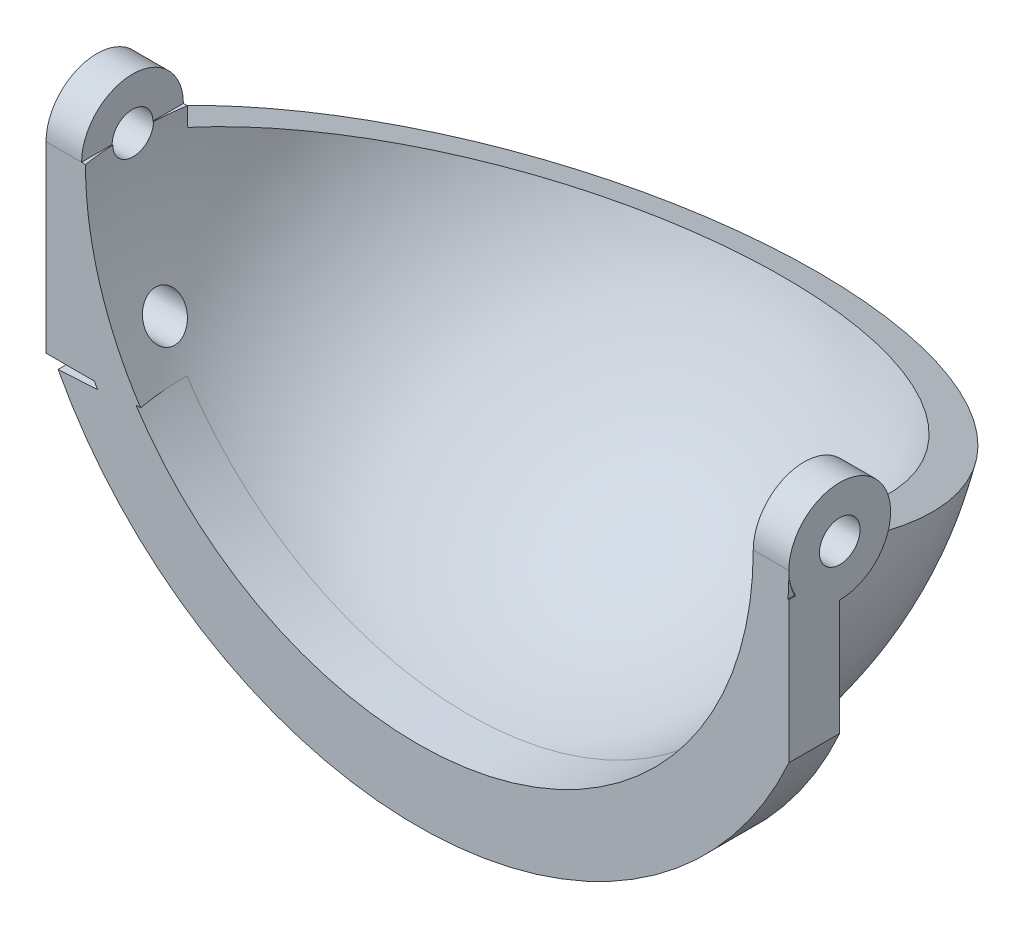
from build123d import *
from build123d.topology import SkipClean

# Parameters (mm, degrees)
EXTRUDE_1_DEPTH          = 2.5
REVOLVE_1_ANGLE          = 70
EXTRUDE_2_DEPTH          = 18.25
EXTRUDE_2_DEPTH_BACK     = 18.25
SKETCH_4_R               = 2.5
SKETCH_4_R_2             = 1
CUT_EXTRUDE_1_DEPTH      = 16.5
CUT_EXTRUDE_1_DEPTH_BACK = 16.5
SKETCH_7_R               = 2.5
SKETCH_7_R_2             = 1
CUT_EXTRUDE_2_DEPTH      = 100
CUT_EXTRUDE_2_DEPTH_BACK = 100
SKETCH_8_R               = 1
EXTRUDE_START            = -5
SKETCH_9_R               = 1
EXTRUDE_3_DEPTH          = 5
CUT_EXTRUDE_START        = -5
SKETCH_12_R              = 1
CUT_EXTRUDE_3_DEPTH      = 5
EXTRUDE_4_DEPTH          = 2.5
CUT_EXTRUDE_4_DEPTH      = 2.5


with BuildPart() as part:
    # 草图1 → 凸台-拉伸1 (new body)
    with BuildSketch(Plane.XY):
        with BuildLine():
            Line((-18.25, 0), (-16.5, 0))
            ThreePointArc((-16.5, 0), (0, -16.5), (16.5, 0))
            Line((16.5, 0), (18.25, 0))
            ThreePointArc((18.25, 0), (0, -18.25), (-18.25, 0))
        make_face()
    extrude(amount=EXTRUDE_1_DEPTH)

    # 草图2 → 旋转1 (revolve)
    with BuildSketch(Plane(origin=(0, 0, 0), x_dir=(-1, 0, 0), z_dir=(0, 0, -1))):
        with BuildLine():
            Line((-17.375, 0), (-16.5, 0))
            ThreePointArc((-16.5, 0), (0, -16.5), (16.5, 0))
            Line((16.5, 0), (17.375, 0))
            Line((17.375, 0), (18.25, 0))
            ThreePointArc((18.25, 0), (0, -18.25), (-18.25, 0))
            Line((-18.25, 0), (-17.375, 0))
        make_face()
    revolve(axis=Axis((16.5, 0, 0), (1, 0, 0)), revolution_arc=REVOLVE_1_ANGLE)

    # 草图4 → 凸台-拉伸2 (add, two sides: drawn at the far end of the back side and taken through both)
    with BuildSketch(Plane(origin=(0, 0, 0), x_dir=(0, 0, -1), z_dir=(1, 0, 0)).offset(-EXTRUDE_2_DEPTH_BACK)):
        Circle(SKETCH_4_R)
        Circle(SKETCH_4_R_2, mode=Mode.SUBTRACT)
    extrude(amount=EXTRUDE_2_DEPTH + EXTRUDE_2_DEPTH_BACK)

    # 草图7 → 切除-拉伸1 (cut, two sides: drawn at the far end of the back side and taken through both)
    with SkipClean():  # the faces are left unmerged after this step: merging them gives an invalid solid
        with BuildSketch(Plane(origin=(0, 0, 0), x_dir=(0, 0, -1), z_dir=(1, 0, 0)).offset(-CUT_EXTRUDE_1_DEPTH_BACK)):
            Circle(SKETCH_7_R)
            Circle(SKETCH_7_R_2, mode=Mode.SUBTRACT)
        extrude(amount=CUT_EXTRUDE_1_DEPTH + CUT_EXTRUDE_1_DEPTH_BACK, mode=Mode.SUBTRACT)

    # 草图8 → 切除-拉伸2 (cut, two sides: drawn at the far end of the back side and taken through both)
    with BuildSketch(Plane(origin=(0, 0, 0), x_dir=(0, 0, -1), z_dir=(1, 0, 0)).offset(-CUT_EXTRUDE_2_DEPTH_BACK)):
        Circle(SKETCH_8_R)
    extrude(amount=CUT_EXTRUDE_2_DEPTH + CUT_EXTRUDE_2_DEPTH_BACK, mode=Mode.SUBTRACT)

    # 草图9 → 凸台-拉伸3 (add)
    with BuildSketch(Plane.ZY.offset(18.25).offset(EXTRUDE_START)):
        with BuildLine():
            Line((1, 0), (2.5, 0))
            Line((2.5, 0), (2.5, -9))
            Line((2.5, -9), (-2.5, -9))
            Line((-2.5, -9), (-2.5, 0))
            Line((-2.5, 0), (-1, 0))
            ThreePointArc((-1, 0), (0, -1), (1, 0))
        make_face()
        with Locations((0, -7)):
            Circle(SKETCH_9_R, mode=Mode.SUBTRACT)
    extrude(amount=EXTRUDE_3_DEPTH)

    # 草图12 → 切除-拉伸3 (cut)
    with BuildSketch(Plane.ZY.offset(18.25).offset(CUT_EXTRUDE_START)):
        with Locations((0, -7)):
            Circle(SKETCH_12_R)
    extrude(amount=CUT_EXTRUDE_3_DEPTH, mode=Mode.SUBTRACT)

    # 草图13 → 切除-旋转1 (revolve, cut)
    with BuildSketch(Plane.XY):
        with BuildLine():
            Line((16.5, 0), (-16.5, 0))
            ThreePointArc((-16.5, 0), (0, -16.5), (16.5, 0))
        make_face()
    revolve(axis=Axis((16.5, 0, 0), (-1, 0, 0)), mode=Mode.SUBTRACT)

    # 草图14 → 凸台-拉伸4 (add)
    with BuildSketch(Plane.XY):
        with BuildLine():
            Line((16.5, -1), (19.945657674, -1.473343123))
            ThreePointArc((19.945657674, -1.473343123), (4.12178771, -19.570663404), (-17.657116061, -9.392883071))
            Line((-17.657116061, -9.392883071), (-13.750126888, -9.175184497))
            ThreePointArc((-13.750126888, -9.175184497), (4.31263967, -15.957792425), (16.5, -1))
        make_face()
    extrude(amount=EXTRUDE_4_DEPTH)

    # 草图15 → 切除-拉伸4 (cut)
    with BuildSketch(Plane(origin=(0, 0, 0), x_dir=(-1, 0, 0), z_dir=(0, 0, -1))):
        Polygon((-19.945657674, -1.473343123), (-18.25, -1.240404168), (-18.25, -11.043121242), (-22.78736169, -5.639500824), align=None)
    extrude(amount=-CUT_EXTRUDE_4_DEPTH, mode=Mode.SUBTRACT)


solid = part.part
